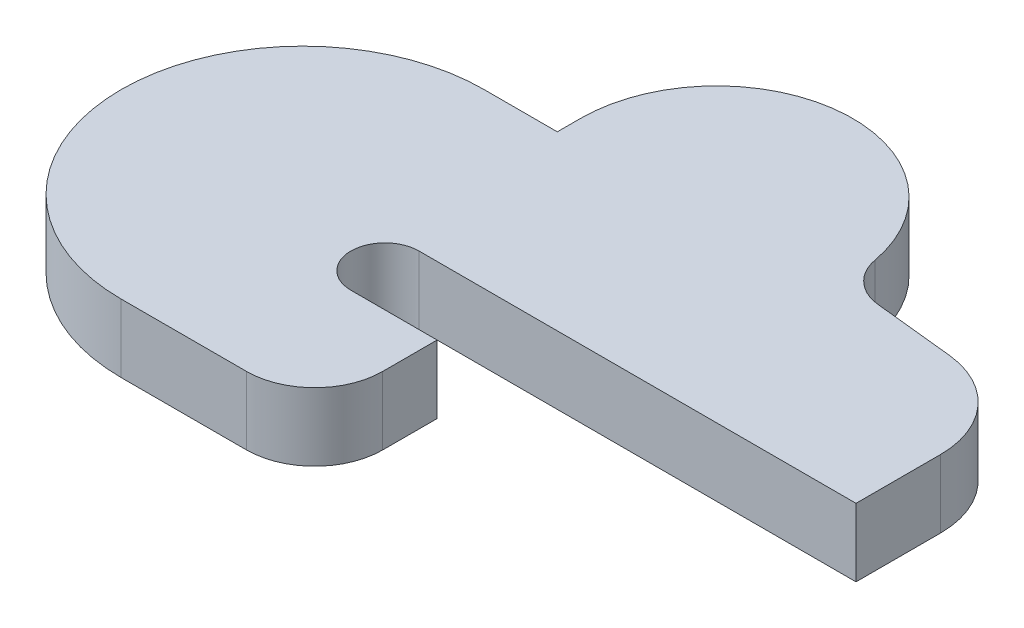
from build123d import *

# Parameters (mm, degrees)
BOSS_EXTRUDE2_DEPTH = 3


with BuildPart() as part:
    # Sketch1 → Boss-Extrude2 (new body)
    with BuildSketch(Plane(origin=(0, 0, 0), x_dir=(1, 0, 0), z_dir=(0, 1, 0))):
        with BuildLine():
            Line((0, 0), (-3.8, 0))
            ThreePointArc((-3.8, 0), (-5.3, 1.5), (-3.8, 3))
            Line((-3.8, 3), (15.47, 3))
            Line((15.47, 3), (15.47, 6.729359541))
            ThreePointArc((15.47, 6.729359541), (14.442579302, 9.405881967), (11.888113853, 10.707447123))
            Line((11.888113853, 10.707447123), (8.35978318, 11.07828962))
            ThreePointArc((8.35978318, 11.07828962), (7.2098211, 11.6), (6.60163008, 12.70666083))
            ThreePointArc((6.60163008, 12.70666083), (0.156759943, 17.6), (-5.3, 11.624643087))
            Line((-5.3, 11.624643087), (-5.3, 10.6))
            Line((-5.3, 10.6), (-8.53, 10.6))
            ThreePointArc((-8.53, 10.6), (-16.53, 2.6), (-8.53, -5.4))
            Line((-8.53, -5.4), (-3, -5.4))
            ThreePointArc((-3, -5.4), (-0.878679656, -4.521320344), (0, -2.4))
            Line((0, -2.4), (0, 0))
        make_face()
    extrude(amount=BOSS_EXTRUDE2_DEPTH)


solid = part.part
